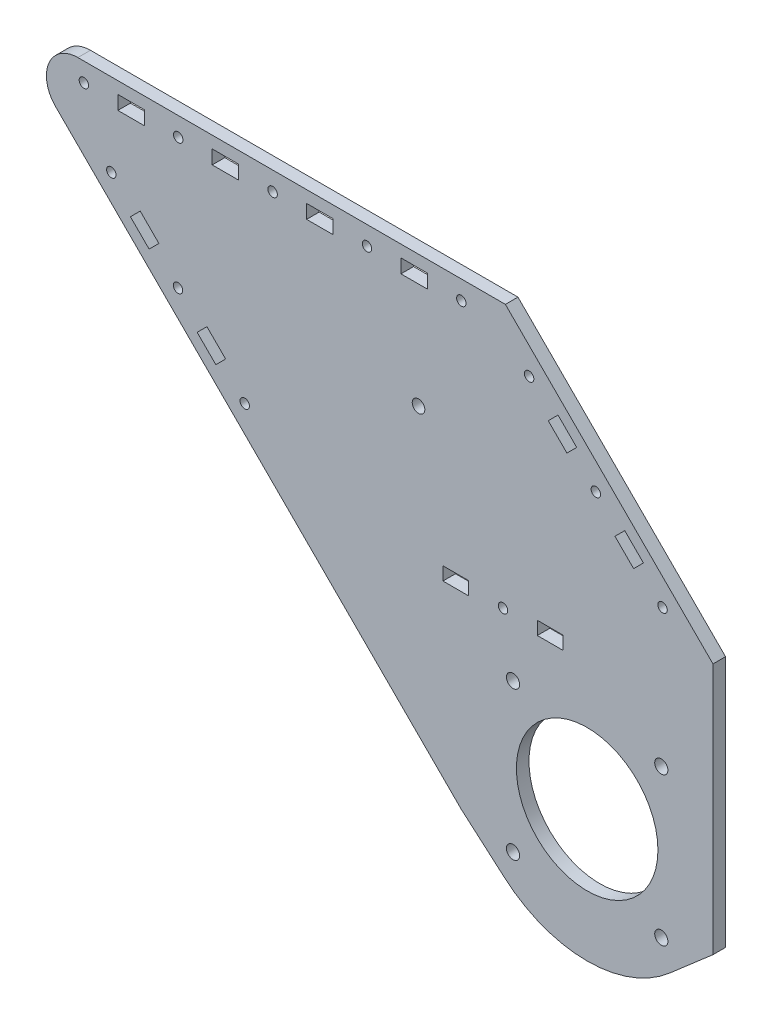
from build123d import *

# Parameters (mm, degrees)
SKETCH_1_R      = 1.5
SKETCH_1_R_2    = 22.5
SKETCH_1_R_3    = 2.1
SKETCH_1_R_4    = 2
SKETCH_1_W      = 8.4
SKETCH_1_H      = 4.4
SKETCH_1_W_2    = 8.2
SKETCH_1_H_2    = 4.2
EXTRUDE_1_DEPTH = 4


with BuildPart() as part:
    # 草图1 → 凸台-拉伸1 (new body)
    with BuildSketch(Plane.XY):
        with BuildLine():
            Line((7.027428163, -5.002489357), (20.810808237, -16.960441938))
            ThreePointArc((20.810808237, -16.960441938), (47.017847244, -26.746287876), (73.227648339, -16.967842153))
            Line((73.227648339, -16.967842153), (87.027428163, -5.002489357))
            Line((87.027428163, -5.002489357), (87.027428163, 75.054738201))
            Line((87.027428163, 75.054738201), (21.027428163, 141.054738201))
            Line((21.027428163, 141.054738201), (-114.887663771, 141.054738201))
            ThreePointArc((-114.887663771, 141.054738201), (-124.126459096, 134.881572525), (-121.958731583, 123.983670389))
            Line((-121.958731583, 123.983670389), (-90.203942848, 92.228881654))
            Line((-90.203942848, 92.228881654), (7.027428163, -5.002489357))
        make_face()
        with Locations((-52.972571837, 135.054738201)):
            Circle(SKETCH_1_R, mode=Mode.SUBTRACT)
        with Locations((47.027428163, 15.054738201)):
            Circle(SKETCH_1_R_2, mode=Mode.SUBTRACT)
        with Locations(Location((-22.972571837, 135.054738201, 0), (0, 0, 180))):
            Circle(SKETCH_1_R, mode=Mode.SUBTRACT)
        with Locations((7.027428163, 135.054738201)):
            Circle(SKETCH_1_R, mode=Mode.SUBTRACT)
        with Locations(Location((-112.972571837, 135.054738201, 0), (0, 0, 180))):
            Circle(SKETCH_1_R, mode=Mode.SUBTRACT)
        with Locations((-82.972571837, 135.054738201)):
            Circle(SKETCH_1_R, mode=Mode.SUBTRACT)
        with Locations((49.784787476, 103.812097514)):
            Circle(SKETCH_1_R, mode=Mode.SUBTRACT)
        with Locations(Location((70.997990912, 82.598894078, 0), (0, 0, 180))):
            Circle(SKETCH_1_R, mode=Mode.SUBTRACT)
        with Locations(Location((28.571584041, 125.025300949, 0), (0, 0, 180))):
            Circle(SKETCH_1_R, mode=Mode.SUBTRACT)
        with Locations((70.597428163, 38.624738201)):
            Circle(SKETCH_1_R_3, mode=Mode.SUBTRACT)
        with Locations((70.597428163, -8.515261799)):
            Circle(SKETCH_1_R_3, mode=Mode.SUBTRACT)
        with Locations((23.457428163, -8.515261799)):
            Circle(SKETCH_1_R_3, mode=Mode.SUBTRACT)
        with Locations((23.457428163, 38.624738201)):
            Circle(SKETCH_1_R_3, mode=Mode.SUBTRACT)
        with Locations((-83.04451802, 93.554738201)):
            Circle(SKETCH_1_R, mode=Mode.SUBTRACT)
        with Locations((-61.831314585, 72.341534765)):
            Circle(SKETCH_1_R, mode=Mode.SUBTRACT)
        with Locations(Location((-104.257721456, 114.767941637, 0), (0, 0, 180))):
            Circle(SKETCH_1_R, mode=Mode.SUBTRACT)
        with Locations((20.275835807, 57.054738201)):
            Circle(SKETCH_1_R, mode=Mode.SUBTRACT)
        with Locations((-6.58531727, 99.226748532)):
            Circle(SKETCH_1_R_4, mode=Mode.SUBTRACT)
        with Locations((-37.972571837, 135.054738201)):
            Rectangle(SKETCH_1_W, SKETCH_1_H, mode=Mode.SUBTRACT)
        with Locations((-7.972571837, 135.054738201)):
            Rectangle(SKETCH_1_W, SKETCH_1_H, mode=Mode.SUBTRACT)
        with Locations((-97.972571837, 135.054738201)):
            Rectangle(SKETCH_1_W, SKETCH_1_H, mode=Mode.SUBTRACT)
        with Locations((-67.972571837, 135.054738201)):
            Rectangle(SKETCH_1_W, SKETCH_1_H, mode=Mode.SUBTRACT)
        Polygon((55.865905794, 94.619709358), (61.805602756, 88.680012396), (64.916872594, 91.791282234), (58.977175632, 97.730979196), align=None, mode=Mode.SUBTRACT)
        Polygon((34.652702359, 115.832912794), (37.763972196, 118.944182631), (43.703669158, 113.004485669), (40.592399321, 109.893215832), align=None, mode=Mode.SUBTRACT)
        Polygon((-73.852129865, 87.473619883), (-76.963399702, 84.362350046), (-71.02370274, 78.422653084), (-67.912432903, 81.533922921), align=None, mode=Mode.SUBTRACT)
        Polygon((-89.125636339, 102.747126356), (-92.236906176, 99.635856519), (-98.176603138, 105.575553481), (-95.065333301, 108.686823318), align=None, mode=Mode.SUBTRACT)
        with Locations((5.275835807, 57.054738201)):
            Rectangle(SKETCH_1_W_2, SKETCH_1_H_2, mode=Mode.SUBTRACT)
        with Locations((35.275835807, 57.054738201)):
            Rectangle(SKETCH_1_W_2, SKETCH_1_H_2, mode=Mode.SUBTRACT)
    extrude(amount=EXTRUDE_1_DEPTH)


solid = part.part
